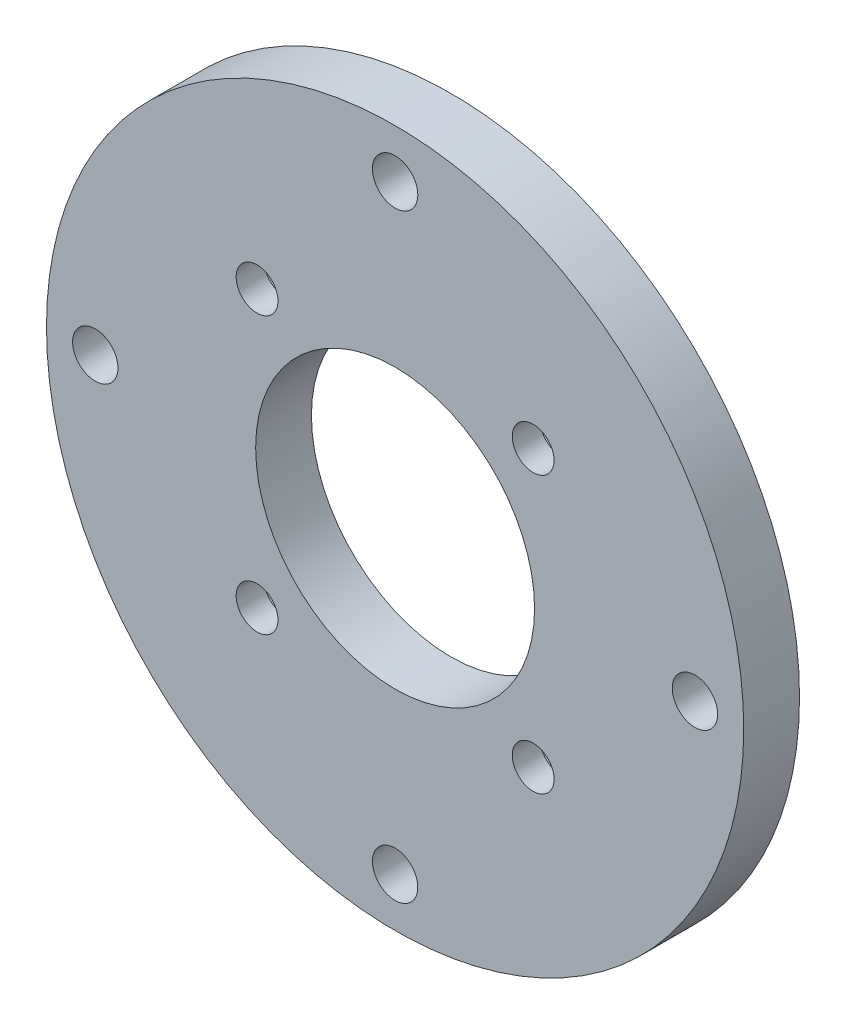
from build123d import *

# Parameters (mm, degrees)
SKETCH1_R           = 125
BOSS_EXTRUDE1_DEPTH = 20
SKETCH2_R           = 50
CUT_EXTRUDE1_DEPTH  = 20
SKETCH3_R           = 8.132820197
CUT_EXTRUDE2_DEPTH  = 20
SKETCH4_R           = 15
CUT_EXTRUDE3_DEPTH  = 10
SKETCH5_R           = 7.5
CUT_EXTRUDE4_DEPTH  = 10
CIRPATTERN1_COUNT   = 4


with BuildPart() as part:
    # Sketch1 → Boss-Extrude1 (new body)
    with BuildSketch(Plane.XY):
        Circle(SKETCH1_R)
    extrude(amount=BOSS_EXTRUDE1_DEPTH)

    # Sketch2 → Cut-Extrude1 (cut)
    with BuildSketch(Plane.XY.offset(20)):
        Circle(SKETCH2_R)
    extrude(amount=-CUT_EXTRUDE1_DEPTH, mode=Mode.SUBTRACT)

    # Sketch3 → Cut-Extrude2 (cut)
    with BuildSketch(Plane.XY.offset(20)):
        with Locations((0, 107.5)):
            Circle(SKETCH3_R)
    cut_extrude2 = extrude(amount=-CUT_EXTRUDE2_DEPTH, mode=Mode.SUBTRACT)

    # Sketch4 → Cut-Extrude3 (cut)
    with BuildSketch(Plane(origin=(0, 0, 0), x_dir=(-1, 0, 0), z_dir=(0, 0, -1))):
        with Locations((49.497474683, 49.497474683)):
            Circle(SKETCH4_R)
    cut_extrude3 = extrude(amount=-CUT_EXTRUDE3_DEPTH, mode=Mode.SUBTRACT)

    # Sketch5 → Cut-Extrude4 (cut)
    with BuildSketch(Plane(origin=(0, 0, 10), x_dir=(-1, 0, 0), z_dir=(0, 0, -1))):
        with Locations((49.497474683, 49.497474683)):
            Circle(SKETCH5_R)
    cut_extrude4 = extrude(amount=-CUT_EXTRUDE4_DEPTH, mode=Mode.SUBTRACT)

    # CirPattern1: Cut-Extrude2, Cut-Extrude3, Cut-Extrude4 ×4 about axis
    cirpattern1_axis = Axis((0, 0, 0), (0, 0, 1))
    add([cut_extrude2.rotate(cirpattern1_axis, i * 360 / CIRPATTERN1_COUNT) for i in range(1, CIRPATTERN1_COUNT)], mode=Mode.SUBTRACT)
    add([cut_extrude3.rotate(cirpattern1_axis, i * 360 / CIRPATTERN1_COUNT) for i in range(1, CIRPATTERN1_COUNT)], mode=Mode.SUBTRACT)
    add([cut_extrude4.rotate(cirpattern1_axis, i * 360 / CIRPATTERN1_COUNT) for i in range(1, CIRPATTERN1_COUNT)], mode=Mode.SUBTRACT)


solid = part.part
